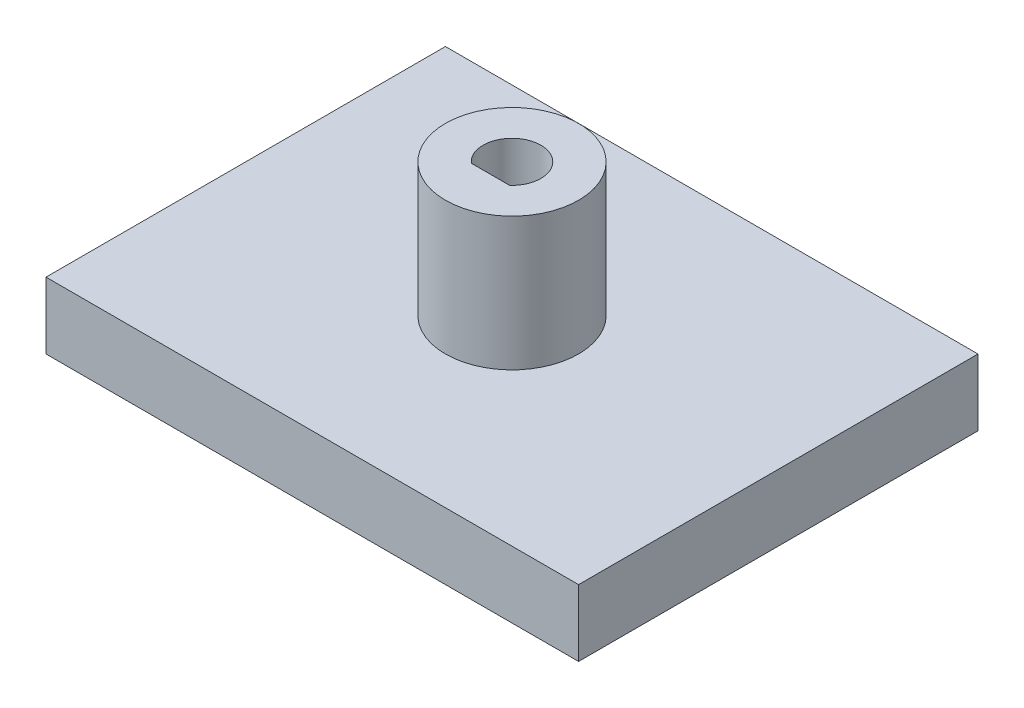
from build123d import *

# Parameters (mm, degrees)
SKETCH1_W           = 50.8
SKETCH1_H           = 38.1
BOSS_EXTRUDE1_DEPTH = 6.35
SKETCH2_R           = 6.35
BOSS_EXTRUDE2_DEPTH = 12.7


with BuildPart() as part:
    # Sketch1 → Boss-Extrude1 (new body)
    with BuildSketch(Plane(origin=(0, 0, 0), x_dir=(1, 0, 0), z_dir=(0, 1, 0))):
        with Locations((25.4, 19.05)):
            Rectangle(SKETCH1_W, SKETCH1_H)
    extrude(amount=BOSS_EXTRUDE1_DEPTH)

    # Sketch2 → Boss-Extrude2 (add)
    with BuildSketch(Plane(origin=(0, 6.35, 0), x_dir=(1, 0, 0), z_dir=(0, 1, 0))):
        with Locations(Location((25.4, 19.05, 0), (0, 0, 270))):
            Circle(SKETCH2_R)
        with BuildLine():
            Line((23.570219541, 16.9926), (27.229780459, 16.9926))
            ThreePointArc((27.229780459, 16.9926), (25.4, 21.80336), (23.570219541, 16.9926))
        make_face(mode=Mode.SUBTRACT)
    extrude(amount=BOSS_EXTRUDE2_DEPTH)


solid = part.part
